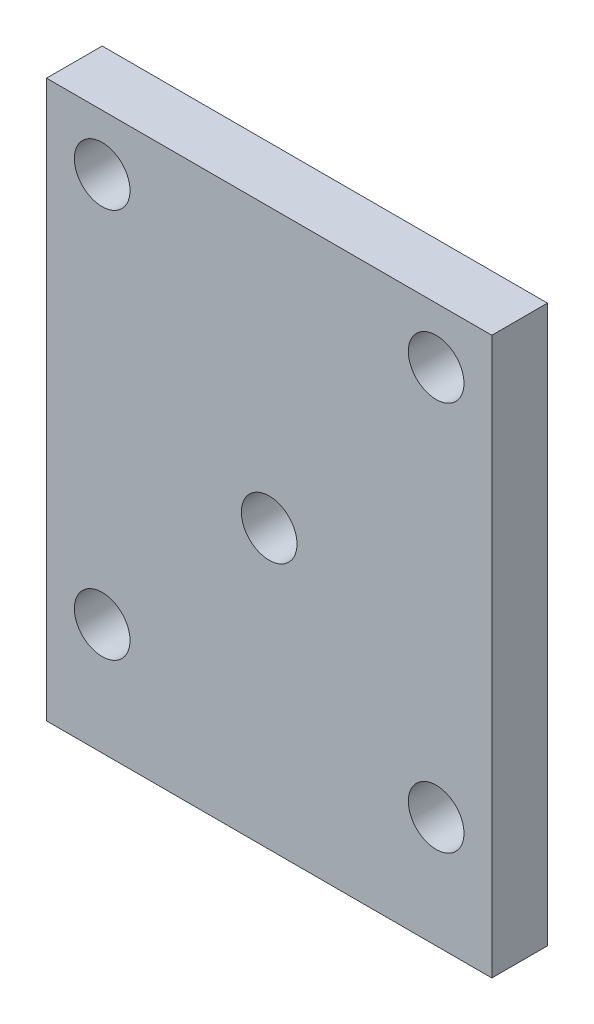
from build123d import *

# Parameters (mm, degrees)
SKETCH1_W           = 101.6
SKETCH1_H           = 127
BOSS_EXTRUDE1_DEPTH = 19.05
SKETCH2_W           = 25.4
SKETCH2_H           = 127
CUT_EXTRUDE1_DEPTH  = 6.35
CUT_EXTRUDE2_REACH  = 165.751
SKETCH4_R           = 6.35
SKETCH9_W           = 50.8
SKETCH9_H           = 50.8
CUT_EXTRUDE7_DEPTH  = 6.35
SKETCH11_R          = 6.35
CUT_EXTRUDE8_DEPTH  = 9.525


with BuildPart() as part:
    # Sketch1 → Boss-Extrude1 (new body)
    with BuildSketch(Plane.XY):
        with Locations((50.8, 63.5)):
            Rectangle(SKETCH1_W, SKETCH1_H)
    extrude(amount=BOSS_EXTRUDE1_DEPTH)

    # Sketch2 → Cut-Extrude1 (cut)
    with BuildSketch(Plane(origin=(0, 0, 0), x_dir=(-1, 0, 0), z_dir=(0, 0, -1))):
        with Locations((-88.9, 63.5)):
            Rectangle(SKETCH2_W, SKETCH2_H)
        with Locations((-12.7, 63.5)):
            Rectangle(SKETCH2_W, SKETCH2_H)
    extrude(amount=-CUT_EXTRUDE1_DEPTH, mode=Mode.SUBTRACT)

    # Sketch4 → Cut-Extrude2 (cut, up to next)
    with BuildSketch(Plane.XY.offset(19.05), mode=Mode.PRIVATE) as cut_extrude2_sk1:
        with Locations((12.7, 114.3)):
            Circle(SKETCH4_R)
    cut_extrude2_tool1 = extrude(cut_extrude2_sk1.sketch, amount=-CUT_EXTRUDE2_REACH, mode=Mode.PRIVATE) & part.part
    # Sketch4 → Cut-Extrude2 (cut, up to next)
    with BuildSketch(Plane.XY.offset(19.05), mode=Mode.PRIVATE) as cut_extrude2_sk2:
        with Locations((12.7, 25.4)):
            Circle(SKETCH4_R)
    cut_extrude2_tool2 = extrude(cut_extrude2_sk2.sketch, amount=-CUT_EXTRUDE2_REACH, mode=Mode.PRIVATE) & part.part
    # Sketch4 → Cut-Extrude2 (cut, up to next)
    with BuildSketch(Plane.XY.offset(19.05), mode=Mode.PRIVATE) as cut_extrude2_sk3:
        with Locations(Location((88.9, 25.4, 0), (0, 0, 180))):
            Circle(SKETCH4_R)
    cut_extrude2_tool3 = extrude(cut_extrude2_sk3.sketch, amount=-CUT_EXTRUDE2_REACH, mode=Mode.PRIVATE) & part.part
    # Sketch4 → Cut-Extrude2 (cut, up to next)
    with BuildSketch(Plane.XY.offset(19.05), mode=Mode.PRIVATE) as cut_extrude2_sk4:
        with Locations(Location((88.9, 114.3, 0), (0, 0, 180))):
            Circle(SKETCH4_R)
    cut_extrude2_tool4 = extrude(cut_extrude2_sk4.sketch, amount=-CUT_EXTRUDE2_REACH, mode=Mode.PRIVATE) & part.part
    add(cut_extrude2_tool1.solids().sort_by_distance((12.7, 114.3, 19.05))[0], mode=Mode.SUBTRACT)
    add(cut_extrude2_tool2.solids().sort_by_distance((12.7, 25.4, 19.05))[0], mode=Mode.SUBTRACT)
    add(cut_extrude2_tool3.solids().sort_by_distance((88.9, 25.4, 19.05))[0], mode=Mode.SUBTRACT)
    add(cut_extrude2_tool4.solids().sort_by_distance((88.9, 114.3, 19.05))[0], mode=Mode.SUBTRACT)

    # Sketch9 → Cut-Extrude7 (cut)
    with BuildSketch(Plane(origin=(0, 0, 0), x_dir=(-1, 0, 0), z_dir=(0, 0, -1))):
        with Locations((-50.8, 25.4)):
            Rectangle(SKETCH9_W, SKETCH9_H)
        with Locations((-50.8, 101.6)):
            Rectangle(SKETCH9_W, SKETCH9_H)
    extrude(amount=-CUT_EXTRUDE7_DEPTH, mode=Mode.SUBTRACT)

    # Sketch11 → Cut-Extrude8 (cut)
    with BuildSketch(Plane.XY.offset(19.05)):
        with Locations((50.8, 63.5)):
            Circle(SKETCH11_R)
    extrude(amount=-CUT_EXTRUDE8_DEPTH, mode=Mode.SUBTRACT)


solid = part.part
